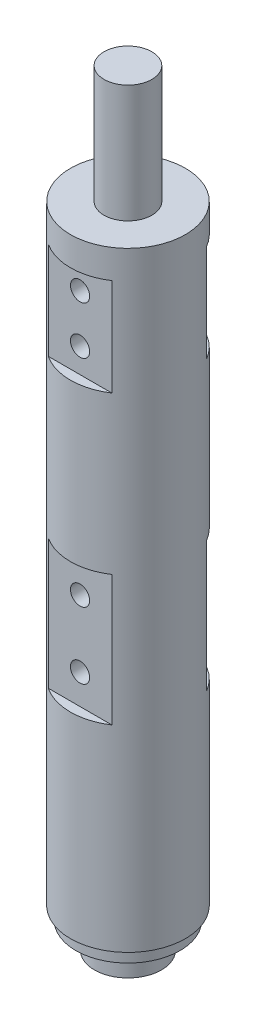
from build123d import *

# Parameters (mm, degrees)
SKETCH1_R               = 19.05
BOSS_EXTRUDE1_DEPTH     = 254
SKETCH2_W               = 11.1125
SKETCH2_H               = 38.989
CUT_EXTRUDE1_DEPTH      = 256.424754086
CUT_EXTRUDE1_DEPTH_BACK = 256.424754086
SKETCH3_W               = 9.525
SKETCH3_H               = 32.258
SKETCH3_H_2             = 43.18
SKETCH3_W_2             = 3.175
F_1_1_DIAMETER_HOLE1_D  = 6.35


with BuildPart() as part:
    # Sketch1 → Boss-Extrude1 (new body)
    with BuildSketch(Plane(origin=(0, 0, 0), x_dir=(1, 0, 0), z_dir=(0, 1, 0))):
        with Locations(Location((0, 0, 0), (0, 0, 270))):
            Circle(SKETCH1_R)
    extrude(amount=BOSS_EXTRUDE1_DEPTH)

    # Sketch2 → Cut-Revolve1 (revolve, cut)
    with BuildSketch(Plane.XY, mode=Mode.PRIVATE) as cut_revolve1_sk:
        Polygon((19.05, 0), (11.1125, 0), (11.1125, 8.636), (17.272, 8.636), (17.272, 12.954), (19.05, 12.954), align=None)
        with Locations((13.49375, 234.5055)):
            Rectangle(SKETCH2_W, SKETCH2_H)
    revolve(cut_revolve1_sk.sketch.rotate(Axis((0, 348.337253792, 0), (0, -1, 0)), 90), axis=Axis((0, 348.337253792, 0), (0, -1, 0)), mode=Mode.SUBTRACT)

    # Sketch3 → Cut-Extrude1 (cut, two sides: drawn at the far end of the back side and taken through both)
    with BuildSketch(Plane(origin=(0, 0, 0), x_dir=(0, 0, -1), z_dir=(1, 0, 0)).offset(-CUT_EXTRUDE1_DEPTH_BACK)):
        with Locations((14.2875, 189.357)):
            Rectangle(SKETCH3_W, SKETCH3_H)
        with Locations((14.2875, 99.568)):
            Rectangle(SKETCH3_W, SKETCH3_H_2)
        with Locations((-17.4625, 189.357)):
            Rectangle(SKETCH3_W_2, SKETCH3_H)
        with Locations((-17.4625, 99.568)):
            Rectangle(SKETCH3_W_2, SKETCH3_H_2)
    extrude(amount=CUT_EXTRUDE1_DEPTH + CUT_EXTRUDE1_DEPTH_BACK, mode=Mode.SUBTRACT)

    # 1 (1) Diameter Hole1 (through all)
    with Locations(Plane(origin=(0, 0, -9.525), x_dir=(-1, 0, 0), z_dir=(0, 0, -1))):
        with Locations((0, 197.2945), (0, 181.4195), (0, 109.982), (0, 87.884)):
            Hole(F_1_1_DIAMETER_HOLE1_D / 2)


solid = part.part
